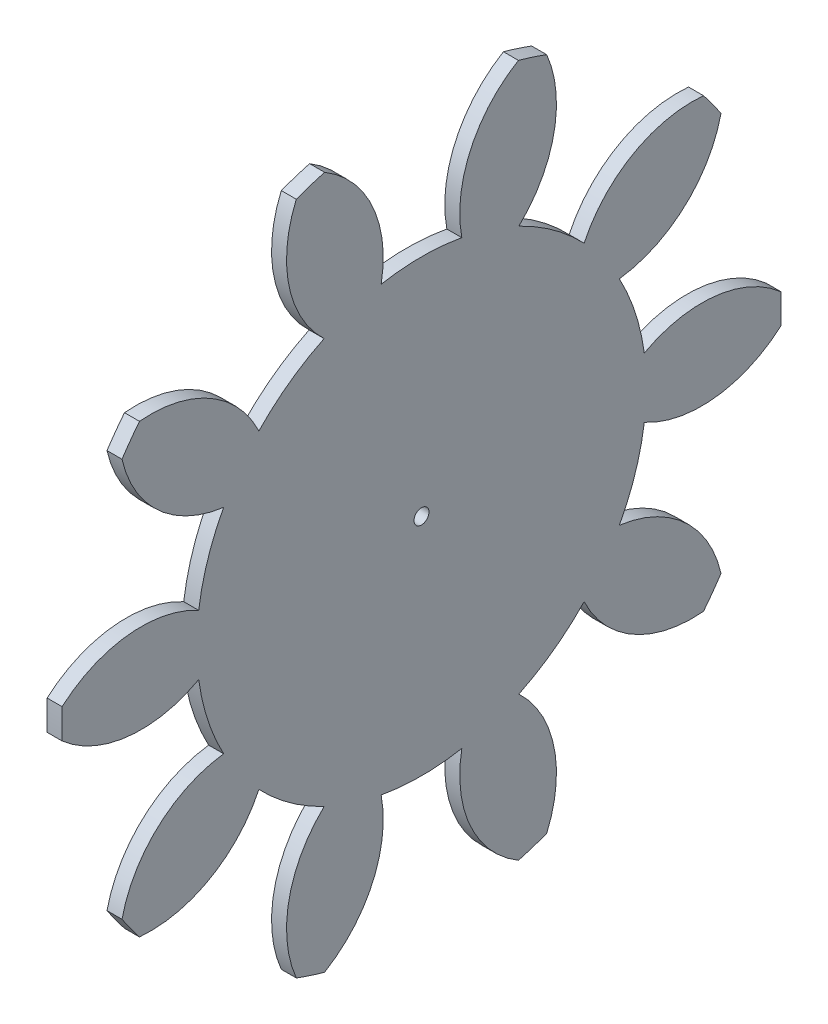
from build123d import *

# Parameters (mm, degrees)
BASPROSKE_W     = 1
BASPROSKE_H     = 24
TOOTHCUT_DEPTH  = 34.955853693
TEETHCUTS_COUNT = 10
TEETHCUTS_ANGLE = 324
BORSKE_R        = 0.5
BORE_DEPTH      = 50.0000508


with BuildPart() as part:
    # BasProSke → Base-Revolve (revolve)
    with BuildSketch(Plane(origin=(0, 0, 0), x_dir=(1, 0, 0), z_dir=(0, 1, 0)), mode=Mode.PRIVATE) as base_revolve_sk:
        with Locations((0.5, 12)):
            Rectangle(BASPROSKE_W, BASPROSKE_H)
    revolve(base_revolve_sk.sketch.rotate(Axis((-10, 0, 0), (1, 0, 0)), 180), axis=Axis((-10, 0, 0), (1, 0, 0)))

    # TooCutSke → ToothCut (cut, through all)
    with BuildSketch(Plane(origin=(0, 0, 0), x_dir=(0, 0, -1), z_dir=(1, 0, 0))):
        with BuildLine():
            ThreePointArc((2.690592193, 14.75570109), (0, 14.999), (-2.690592193, 14.75570109))
            ThreePointArc((-2.690592193, 14.75570109), (-3.269624345, 19.544793041), (-6.49681245, 23.130310702))
            ThreePointArc((-6.49681245, 23.130310702), (0, 24.0254), (6.49681245, 23.130310702))
            ThreePointArc((6.49681245, 23.130310702), (3.269624345, 19.544793041), (2.690592193, 14.75570109))
        make_face()
    toothcut = extrude(amount=TOOTHCUT_DEPTH, mode=Mode.SUBTRACT)

    # TeethCuts: ToothCut ×10 about axis
    teethcuts_axis = Axis((-10, 0, 0), (1, 0, 0))
    for i in range(1, TEETHCUTS_COUNT):
        add(toothcut.rotate(teethcuts_axis, i * TEETHCUTS_ANGLE / (TEETHCUTS_COUNT - 1)), mode=Mode.SUBTRACT)

    # BorSke → Bore (cut, symmetric)
    with BuildSketch(Plane(origin=(0, 0, 0), x_dir=(0, 0, -1), z_dir=(1, 0, 0))):
        with Locations(Location((0, 0, 0), (0, 0, 180))):
            Circle(BORSKE_R)
    extrude(amount=BORE_DEPTH, both=True, mode=Mode.SUBTRACT)


solid = part.part
